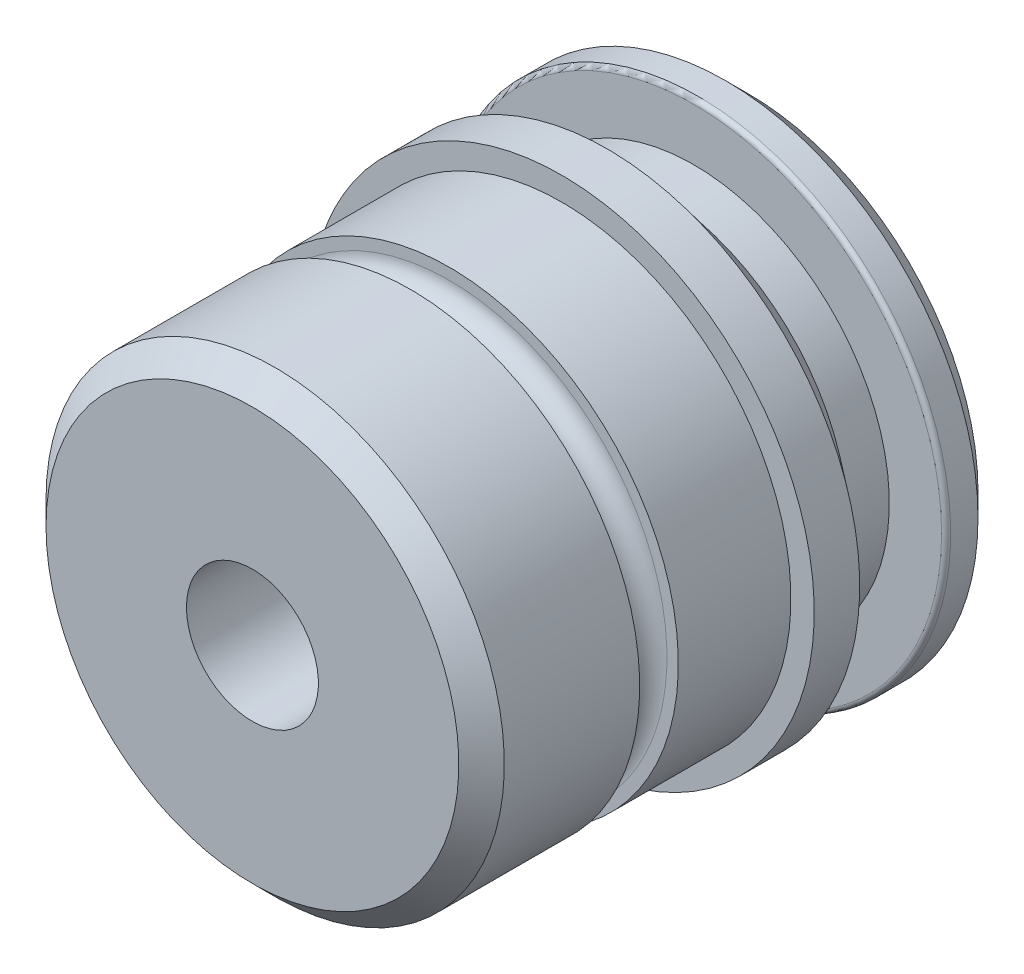
from build123d import *

# Parameters (mm, degrees)
CHAMFER_1_SIZE = 1
CHAMFER_2_SIZE = 1
FILLET_1_R     = 0.2


with BuildPart() as part:
    # 스케치3 → 회전2 (revolve)
    with BuildSketch(Plane(origin=(0, 0, 0), x_dir=(1, 0, 0), z_dir=(0, 1, 0)), mode=Mode.PRIVATE) as revolve_2_sk:
        with BuildLine():
            Line((11.1, 0), (11.1, -2.4))
            Line((11.1, -2.4), (8.6, -2.4))
            Line((8.6, -2.4), (8.6, -4.2))
            Line((8.6, -4.2), (11.1, -6.2))
            Line((11.1, -6.2), (11.1, -8.2))
            Line((11.1, -8.2), (10.075, -8.2))
            Line((10.075, -8.2), (10.075, -13.15))
            Line((10.075, -13.15), (9.575, -13.15))
            ThreePointArc((9.575, -13.15), (8.725, -14), (9.575, -14.85))
            Line((9.575, -14.85), (10.075, -14.85))
            Line((10.075, -14.85), (10.075, -21.8))
            Line((10.075, -21.8), (2.9, -21.8))
            Line((2.9, -21.8), (2.9, -11.8))
            Line((2.9, -11.8), (4.4, -11.8))
            Line((4.4, -11.8), (4.4, -10))
            Line((4.4, -10), (3.4, -10))
            Line((3.4, -10), (3.4, -8.2))
            Line((3.4, -8.2), (5.5, -7.637306696))
            Line((5.5, -7.637306696), (5.5, 0))
            Line((5.5, 0), (11.1, 0))
        make_face()
    revolve(revolve_2_sk.sketch.rotate(Axis((0, 0, 0), (0, 0, 1)), 180), axis=Axis((0, 0, 0), (0, 0, 1)))

    # 모따기1
    chamfer_1_edges = [part.edges().sort_by_distance(p)[0] for p in [
        (10.075, 0, 21.8),
        (5.5, 0, 0),
    ]]
    chamfer(chamfer_1_edges, length=CHAMFER_1_SIZE)

    # 모따기2
    chamfer_2_edges = [part.edges().sort_by_distance(p)[0] for p in [
        (11.1, 0, 0),
    ]]
    chamfer(chamfer_2_edges, length=CHAMFER_2_SIZE)

    # 필렛1
    fillet_1_edges = [part.edges().sort_by_distance(p)[0] for p in [
        (11.1, 0, 2.4),
    ]]
    fillet(fillet_1_edges, radius=FILLET_1_R)


solid = part.part
